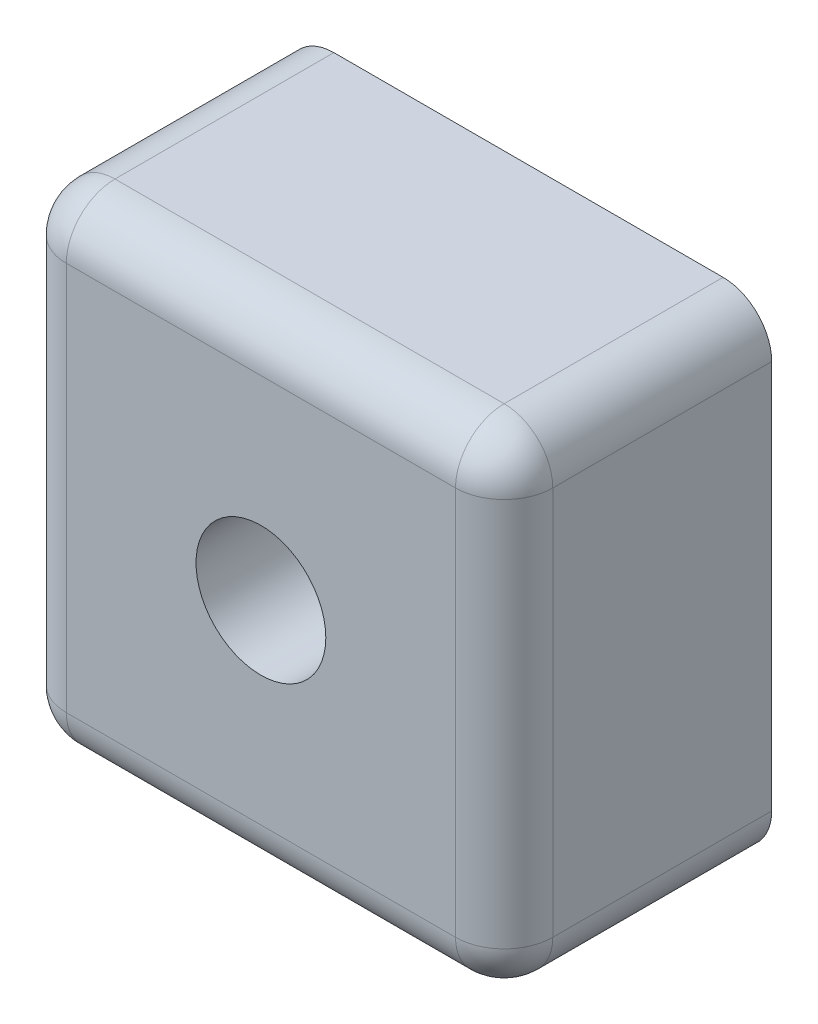
from build123d import *

# Parameters (mm, degrees)
EXTRUDE_1_DEPTH = 55
FILLET_2_R      = 10
FILLET_3_R      = 10


with BuildPart() as part:
    # 草图1 → 凸台-拉伸1 (new body)
    with BuildSketch(Plane.XY):
        with BuildLine():
            Line((-50, 50), (-50, -50))
            Line((-50, -50), (0, -50))
            Line((0, -50), (0, -28.382636481))
            ThreePointArc((0, -28.382636481), (-28.382636481, 0), (0, 28.382636481))
            Line((0, 28.382636481), (0, 50))
            Line((0, 50), (-50, 50))
        make_face()
        with BuildLine():
            Line((50, 50), (0, 50))
            Line((0, 50), (0, 28.382636481))
            ThreePointArc((0, 28.382636481), (20.069554724, 20.069554724), (28.382636481, 0))
            Line((28.382636481, 0), (50, 0))
            Line((50, 0), (50, 50))
        make_face()
        with BuildLine():
            Line((0, -13.339839146), (0, -28.382636481))
            ThreePointArc((0, -28.382636481), (20.069554724, -20.069554724), (28.382636481, 0))
            Line((28.382636481, 0), (13.339839146, 0))
            ThreePointArc((13.339839146, 0), (9.43269072, -9.43269072), (0, -13.339839146))
        make_face()
        with BuildLine():
            ThreePointArc((28.382636481, 0), (20.069554724, 20.069554724), (0, 28.382636481))
            Line((0, 28.382636481), (0, 13.339839146))
            ThreePointArc((0, 13.339839146), (9.43269072, 9.43269072), (13.339839146, 0))
            Line((13.339839146, 0), (28.382636481, 0))
        make_face()
        with BuildLine():
            ThreePointArc((0, 28.382636481), (-28.382636481, 0), (0, -28.382636481))
            Line((0, -28.382636481), (0, -13.339839146))
            ThreePointArc((0, -13.339839146), (-13.339839146, 0), (0, 13.339839146))
            Line((0, 13.339839146), (0, 28.382636481))
        make_face()
        with BuildLine():
            Line((0, -28.382636481), (0, -50))
            Line((0, -50), (50, -50))
            Line((50, -50), (50, 0))
            Line((50, 0), (28.382636481, 0))
            ThreePointArc((28.382636481, 0), (20.069554724, -20.069554724), (0, -28.382636481))
        make_face()
    extrude(amount=EXTRUDE_1_DEPTH)

    # 圆角2
    fillet_2_edges = [part.edges().sort_by_distance(p)[0] for p in [
        (50, -50, 27.5),
        (-50, -50, 27.5),
        (-50, 50, 27.5),
        (50, 50, 27.5),
    ]]
    fillet(fillet_2_edges, radius=FILLET_2_R)

    # 圆角3
    fillet_3_edges = [part.edges().sort_by_distance(p)[0] for p in [
        (0, -50, 55),
        (-50, 0, 55),
        (50, 0, 55),
        (0, 50, 55),
        (-47.071067812, 47.071067812, 55),
        (47.071067812, 47.071067812, 55),
        (47.071067812, -47.071067812, 55),
        (-47.071067812, -47.071067812, 55),
    ]]
    fillet(fillet_3_edges, radius=FILLET_3_R)


solid = part.part
